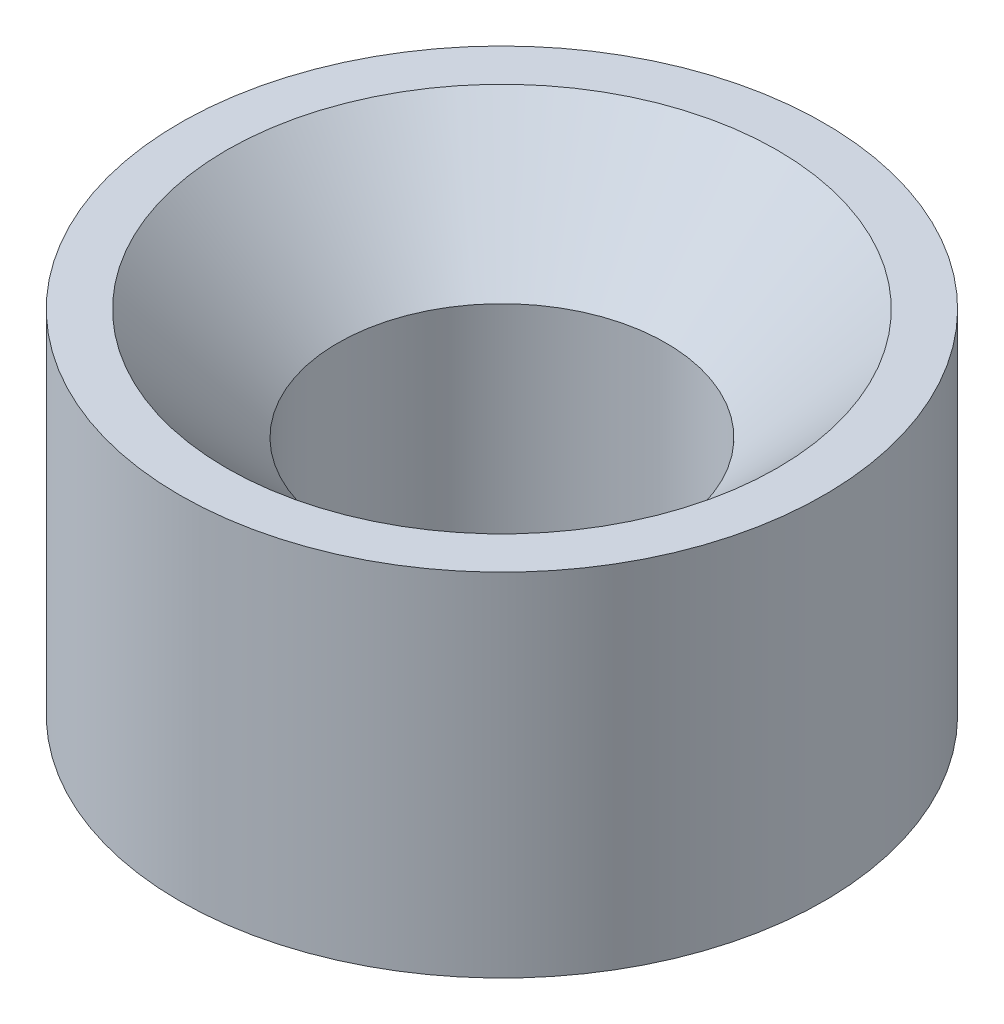
from build123d import *

# Parameters (mm, degrees)
SKETCH1_R           = 2.75
SKETCH1_R_2         = 1.4
BOSS_EXTRUDE1_DEPTH = 1.5
CHAMFER1_SIZE       = 0.95


with BuildPart() as part:
    # Sketch1 → Boss-Extrude1 (new, symmetric)
    with BuildSketch(Plane(origin=(0, 0, 0), x_dir=(1, 0, 0), z_dir=(0, 1, 0))):
        with Locations(Location((0, 0, 0), (0, 0, 270))):
            Circle(SKETCH1_R)
        with Locations(Location((0, 0, 0), (0, 0, 270))):
            Circle(SKETCH1_R_2, mode=Mode.SUBTRACT)
    extrude(amount=BOSS_EXTRUDE1_DEPTH, both=True)

    # Chamfer1
    chamfer1_edges = [part.edges().sort_by_distance(p)[0] for p in [
        (0, 1.5, -1.4),
    ]]
    chamfer(chamfer1_edges, length=CHAMFER1_SIZE)


solid = part.part
